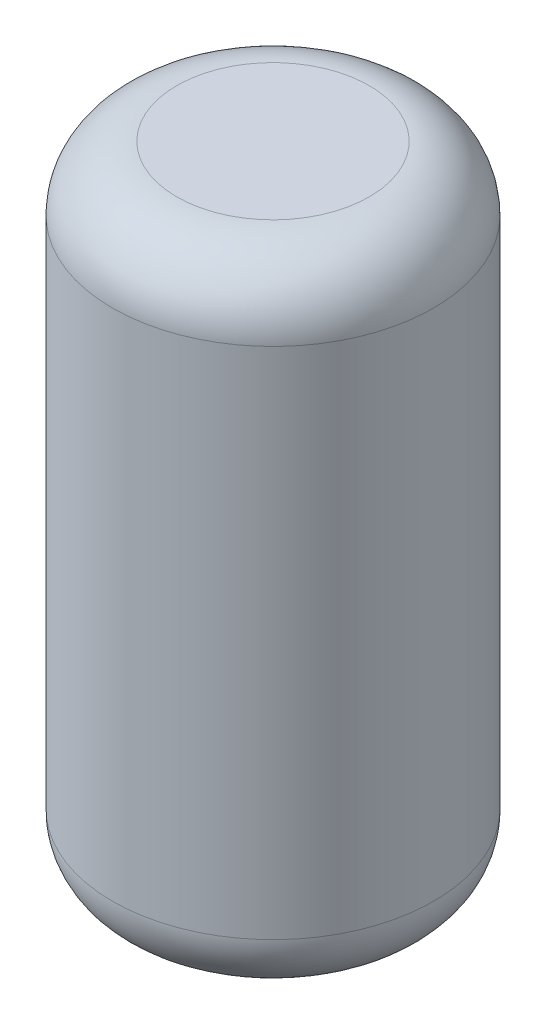
from build123d import *

# Parameters (mm, degrees)
CROQUIS1_R              = 2.5
SALIENTE_EXTRUIR2_DEPTH = 5
REDONDEO2_R             = 1


with BuildPart() as part:
    # Croquis1 → Saliente-Extruir2 (new, symmetric)
    with BuildSketch(Plane(origin=(0, 0, 0), x_dir=(1, 0, 0), z_dir=(0, 1, 0))):
        with Locations(Location((0, 0, 0), (0, 0, 270))):
            Circle(CROQUIS1_R)
    extrude(amount=SALIENTE_EXTRUIR2_DEPTH, both=True)

    # Redondeo2
    redondeo2_edges = [part.edges().sort_by_distance(p)[0] for p in [
        (0, -5, -2.5),
        (0, 5, -2.5),
    ]]
    fillet(redondeo2_edges, radius=REDONDEO2_R)


solid = part.part
